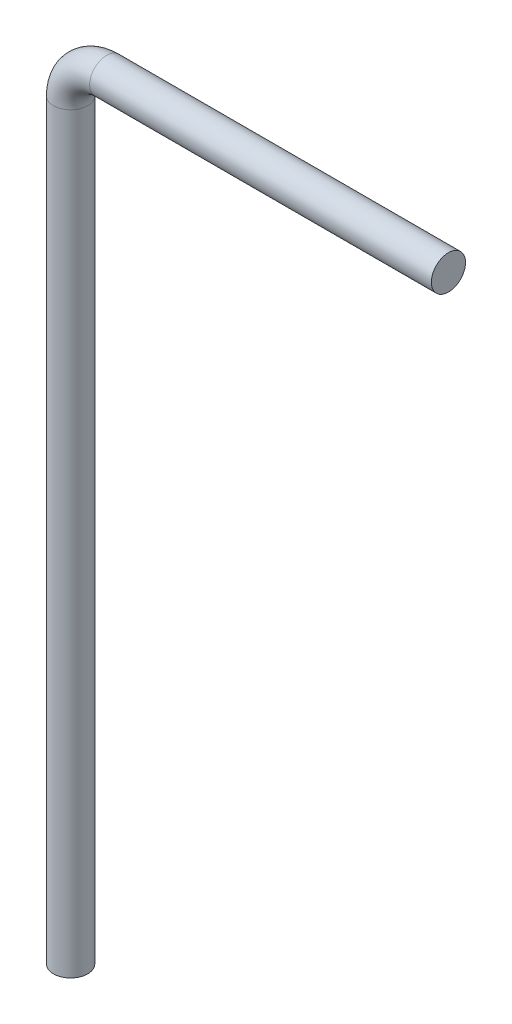
from build123d import *

# Parameters (mm, degrees)
VARREDURA1_PROFILE_R = 2.5


with BuildPart() as part:
    # Varredura1: sweep along a path in Esboço1
    with BuildLine(Plane.XY) as varredura1_path:
        Line((0, -55), (0, 55))
        ThreePointArc((0, 55), (1.545987988, 58.732345167), (5.278333155, 60.278333155))
        Line((5.278333155, 60.278333155), (55.278333155, 60.278333155))
    # Varredura1 profile (on start of the path) → Varredura1 (sweep)
    with BuildSketch(Plane.ZX.offset(-55)):
        Circle(VARREDURA1_PROFILE_R)
    sweep(path=varredura1_path.line)


solid = part.part
